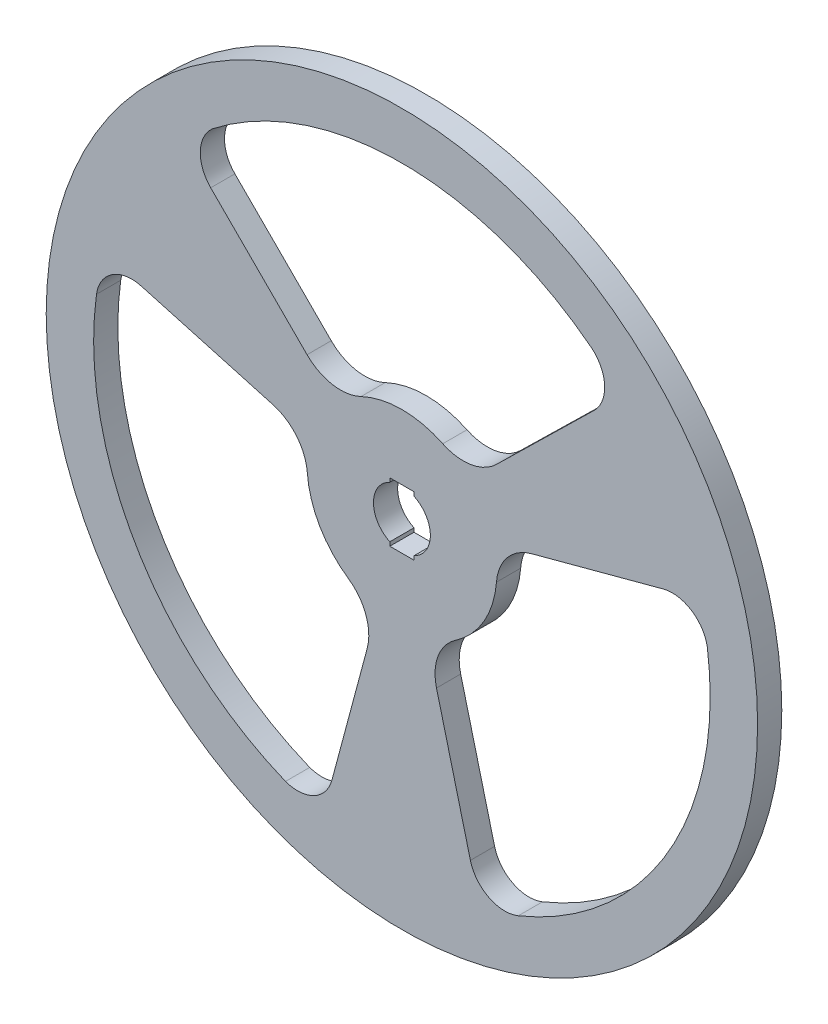
from build123d import *

# Parameters (mm, degrees)
SKETCH1_R          = 75
SKETCH1_R_2        = 6
EXTRUSION1_DEPTH   = 5.1
CUT_EXTRUDE1_DEPTH = 107.188558706


with BuildPart() as part:
    # Sketch1 → Extrusion1 (new body)
    with BuildSketch(Plane.XY):
        Circle(SKETCH1_R)
        Circle(SKETCH1_R_2, mode=Mode.SUBTRACT)
        with BuildLine():
            ThreePointArc((40.502817464, 40.06150101), (42.745132776, 45.851099569), (39.856206804, 51.346691998))
            ThreePointArc((39.856206804, 51.346691998), (0, 65), (-39.856206804, 51.346691998))
            ThreePointArc((-39.856206804, 51.346691998), (-42.506769406, 45.932667816), (-40.316594862, 40.316594862))
            Line((-40.316594862, 40.316594862), (-20, 20))
            ThreePointArc((-20, 20), (-14.619951975, 17.215082215), (-8.619288125, 18.047378541))
            ThreePointArc((-8.619288125, 18.047378541), (0, 20), (8.619288125, 18.047378541))
            ThreePointArc((8.619288125, 18.047378541), (14.566416982, 17.206046598), (19.922803859, 19.923637571))
            Line((19.922803859, 19.923637571), (40.502817464, 40.06150101))
        make_face(mode=Mode.SUBTRACT)
        with BuildLine():
            ThreePointArc((-54.945686321, 15.045718344), (-61.080783406, 14.092821088), (-64.395643073, 8.843141592))
            ThreePointArc((-64.395643073, 8.843141592), (-56.291651246, -32.5), (-24.539436269, -60.18983359))
            ThreePointArc((-24.539436269, -60.18983359), (-18.525472489, -59.778276047), (-14.756897914, -55.073492776))
            Line((-14.756897914, -55.073492776), (-7.320508076, -27.320508076))
            ThreePointArc((-7.320508076, -27.320508076), (-7.598722539, -21.26879092), (-11.319844226, -16.48821175))
            ThreePointArc((-11.319844226, -16.48821175), (-17.320508076, -10), (-19.939132351, -1.559166791))
            ThreePointArc((-19.939132351, -1.559166791), (-22.184081943, 4.011863849), (-27.215778201, 7.291835471))
            Line((-27.215778201, 7.291835471), (-54.945686321, 15.045718344))
        make_face(mode=Mode.SUBTRACT)
        with BuildLine():
            ThreePointArc((14.442868856, -55.107219354), (18.33565063, -59.943920657), (24.539436269, -60.18983359))
            ThreePointArc((24.539436269, -60.18983359), (56.291651246, -32.5), (64.395643073, 8.843141592))
            ThreePointArc((64.395643073, 8.843141592), (61.032241895, 13.845608231), (55.073492776, 14.756897914))
            Line((55.073492776, 14.756897914), (27.320508076, 7.320508076))
            ThreePointArc((27.320508076, 7.320508076), (22.218674514, 4.053708705), (19.939132351, -1.559166791))
            ThreePointArc((19.939132351, -1.559166791), (17.320508076, -10), (11.319844226, -16.48821175))
            ThreePointArc((11.319844226, -16.48821175), (7.617664962, -21.217910447), (7.292974343, -27.215473042))
            Line((7.292974343, -27.215473042), (14.442868856, -55.107219354))
        make_face(mode=Mode.SUBTRACT)
    extrude(amount=EXTRUSION1_DEPTH)

    # Sketch2 → Cut-Extrude1 (cut, through all)
    with BuildSketch(Plane.XY.offset(5.1)):
        with BuildLine():
            ThreePointArc((-2.55, -5.431160097), (0, -6), (2.55, -5.431160097))
            Line((2.55, -5.431160097), (2.55, 5.431160097))
            ThreePointArc((2.55, 5.431160097), (0, 6), (-2.55, 5.431160097))
            Line((-2.55, 5.431160097), (-2.55, -5.431160097))
        make_face()
        with BuildLine():
            ThreePointArc((-2.55, 5.431160097), (0, 6), (2.55, 5.431160097))
            Line((2.55, 5.431160097), (2.55, 6.25))
            Line((2.55, 6.25), (-2.55, 6.25))
            Line((-2.55, 6.25), (-2.55, 5.431160097))
        make_face()
        with BuildLine():
            Line((-2.55, -6.25), (2.55, -6.25))
            Line((2.55, -6.25), (2.55, -5.431160097))
            ThreePointArc((2.55, -5.431160097), (0, -6), (-2.55, -5.431160097))
            Line((-2.55, -5.431160097), (-2.55, -6.25))
        make_face()
    extrude(amount=-CUT_EXTRUDE1_DEPTH, mode=Mode.SUBTRACT)


solid = part.part
